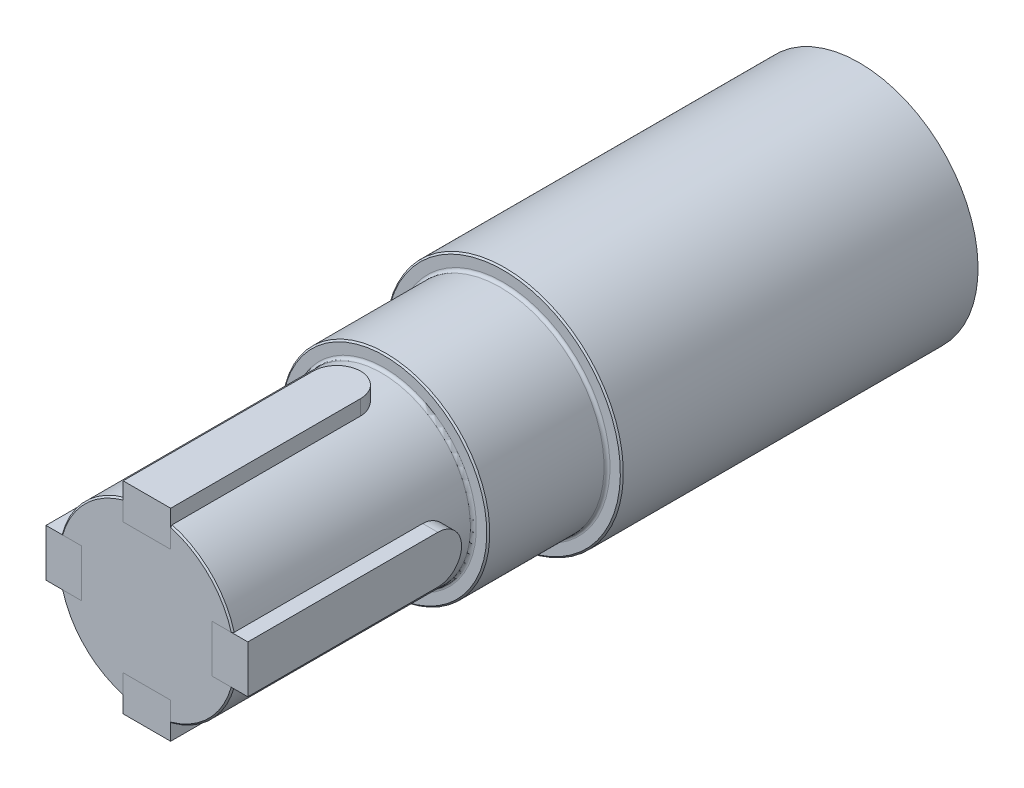
from build123d import *

# Parameters (mm, degrees)
CUT_EXTRUDE1_START  = 11
CUT_EXTRUDE1_DEPTH  = 10
CIRPATTERN1_COUNT   = 4
BOSS_EXTRUDE1_DEPTH = 6
CIRPATTERN2_COUNT   = 4
FILLET1_R           = 0.5
CHAMFER1_SIZE       = 0.25


with BuildPart() as part:
    # Sketch1 → Revolve1 (revolve)
    with BuildSketch(Plane(origin=(0, 0, 0), x_dir=(0, 0, -1), z_dir=(1, 0, 0))):
        Polygon((0, 0), (0, 15), (40, 15), (40, 17.5), (60, 17.5), (60, 20), (120, 20), (120, 0), align=None)
    revolve(axis=Axis((0, 0, -120), (0, 0, 1)))

    # Sketch2 → Cut-Extrude1 (cut)
    with BuildSketch(Plane(origin=(0, 0, 0), x_dir=(1, 0, 0), z_dir=(0, 1, 0)).offset(CUT_EXTRUDE1_START)):
        with BuildLine():
            Line((-4, 0), (-4, 32))
            ThreePointArc((-4, 32), (0, 36), (4, 32))
            Line((4, 32), (4, 0))
            ThreePointArc((4, 0), (0, -4), (-4, 0))
        make_face()
    cut_extrude1 = extrude(amount=CUT_EXTRUDE1_DEPTH, mode=Mode.SUBTRACT)

    # CirPattern1: Cut-Extrude1 ×4 about axis
    cirpattern1_axis = Axis((0, 0, 0), (0, 0, 1))
    for i in range(1, CIRPATTERN1_COUNT):
        add(cut_extrude1.rotate(cirpattern1_axis, i * 360 / CIRPATTERN1_COUNT), mode=Mode.SUBTRACT)

    # Fillet1
    fillet1_edges = [part.edges().sort_by_distance(p)[0] for p in [
        (0, -17.5, -60),
        (0, -15, -40),
    ]]
    fillet(fillet1_edges, radius=FILLET1_R)

    # Chamfer1
    chamfer1_edges = [part.edges().sort_by_distance(p)[0] for p in [
        (10.606601718, -10.606601718, 0),
        (-10.606601718, -10.606601718, 0),
        (-10.606601718, 10.606601718, 0),
        (0, -20, -60),
        (0, -17.5, -40),
        (10.606601718, 10.606601718, 0),
    ]]
    chamfer(chamfer1_edges, length=CHAMFER1_SIZE)


with BuildPart() as body_2:
    # Sketch3 → Boss-Extrude1 (new body)
    with BuildSketch(Plane(origin=(0, 11, 0), x_dir=(1, 0, 0), z_dir=(0, 1, 0))):
        with BuildLine():
            Line((4, 0), (4, 32))
            ThreePointArc((4, 32), (0, 36), (-4, 32))
            Line((-4, 32), (-4, 0))
            Line((-4, 0), (4, 0))
        make_face()
    extrude(amount=BOSS_EXTRUDE1_DEPTH)


with BuildPart() as cirpattern2_1:
    # CirPattern2: pattern copy
    add(body_2.part.rotate(Axis((0, 0, 0), (0, 0, 1)), 1 * 360 / CIRPATTERN2_COUNT))


with BuildPart() as cirpattern2_2:
    # CirPattern2: pattern copy
    add(body_2.part.rotate(Axis((0, 0, 0), (0, 0, 1)), 2 * 360 / CIRPATTERN2_COUNT))


with BuildPart() as cirpattern2_3:
    # CirPattern2: pattern copy
    add(body_2.part.rotate(Axis((0, 0, 0), (0, 0, 1)), 3 * 360 / CIRPATTERN2_COUNT))


solid = Compound([part.part, body_2.part, cirpattern2_1.part, cirpattern2_2.part, cirpattern2_3.part])
